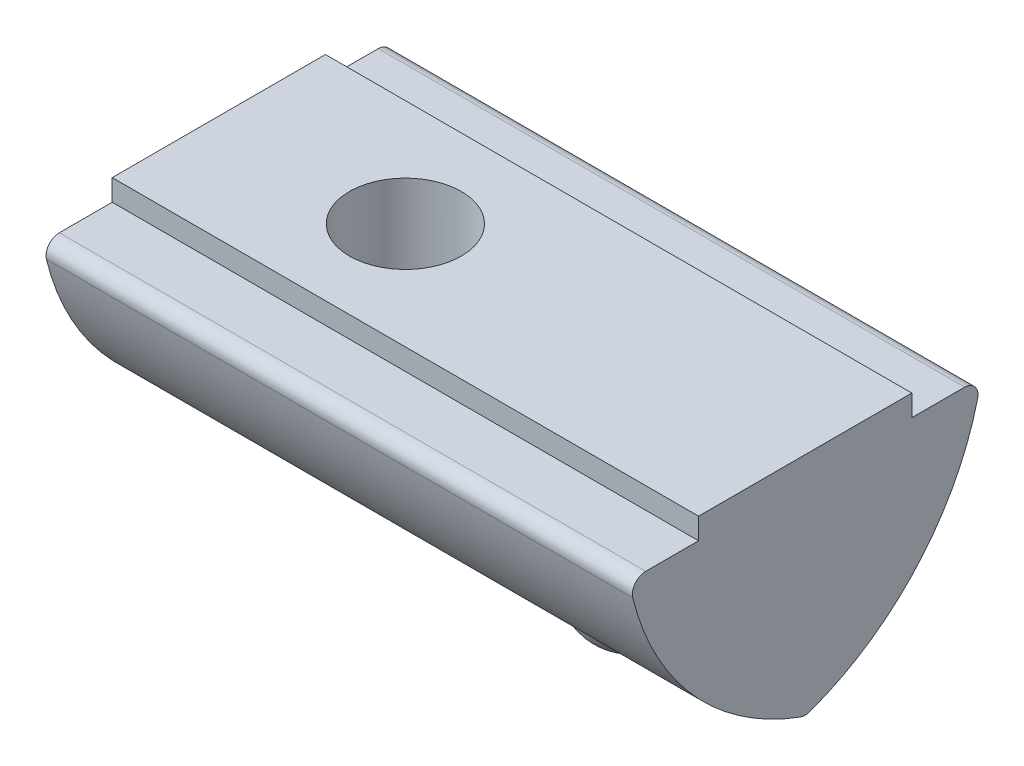
from build123d import *

# Parameters (mm, degrees)
DODANIE_WYCI_GNI_CIE1_DEPTH = 11
ZAOKR_GLENIE1_R             = 0.5
OTW_R_GWINTOWANY_M51_D      = 4.2


with BuildPart() as part:
    # Szkic1 → Dodanie-wyciągnięcie1 (new, symmetric)
    with BuildSketch(Plane(origin=(0, 0, 0), x_dir=(0, 0, -1), z_dir=(1, 0, 0))):
        with BuildLine():
            Line((-4, 0), (4, 0))
            Line((4, 0), (4, -0.8))
            Line((4, -0.8), (6.6, -0.8))
            ThreePointArc((6.6, -0.8), (4.348518436, -5.548730088), (0, -8.5))
            ThreePointArc((0, -8.5), (-4.348518436, -5.548730088), (-6.6, -0.8))
            Line((-6.6, -0.8), (-4, -0.8))
            Line((-4, -0.8), (-4, 0))
        make_face()
    extrude(amount=DODANIE_WYCI_GNI_CIE1_DEPTH, both=True)

    # Zaokrąglenie1
    zaokr_glenie1_edges = [part.edges().sort_by_distance(p)[0] for p in [
        (0, -0.8, -6.6),
        (0, -8.5, 0),
        (0, -0.8, 6.6),
    ]]
    fillet(zaokr_glenie1_edges, radius=ZAOKR_GLENIE1_R)

    # Otwór gwintowany M51 (through all)
    with Locations(Plane(origin=(0, 0, 0), x_dir=(1, 0, 0), z_dir=(0, 1, 0))):
        with Locations((-4, 0)):
            Hole(OTW_R_GWINTOWANY_M51_D / 2)

    # Szkic4 → Obrót1 (revolve)
    with BuildSketch(Plane.ZY.offset(-4.5)):
        with BuildLine():
            Line((0, -5.3), (0, -9.3))
            ThreePointArc((0, -9.3), (2, -7.3), (0, -5.3))
        make_face()
    revolve(axis=Axis((4.5, -5.3, 0), (0, -1, 0)))


solid = part.part
